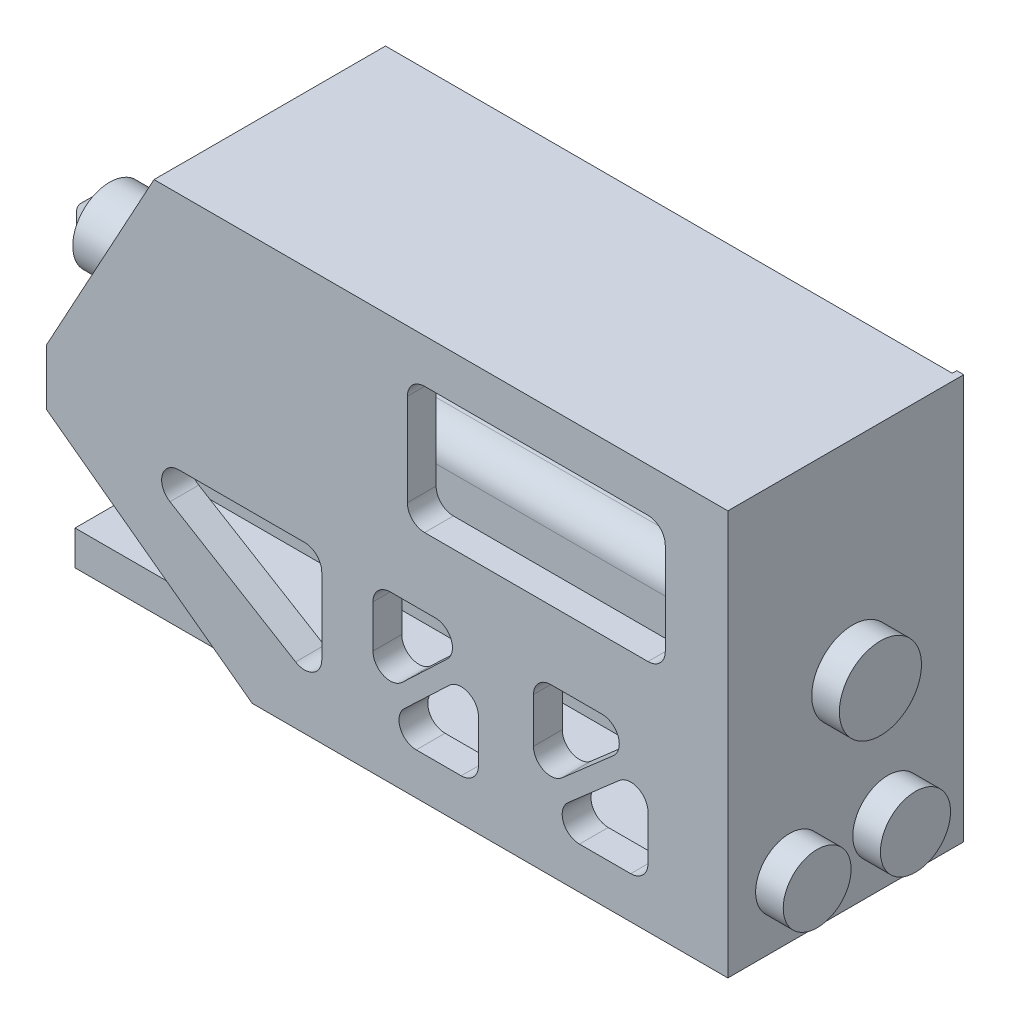
from build123d import *

# Parameters (mm, degrees)
SKETCH1_W           = 297.73626
SKETCH1_H           = 182.7784
BOSS_EXTRUDE1_DEPTH = 15.24
CUT_EXTRUDE1_DEPTH  = 350.695698609
CUT_EXTRUDE2_DEPTH  = 350.695698609
SKETCH5_W           = 297.73626
SKETCH5_H           = 50.702926555
BOSS_EXTRUDE2_DEPTH = 76.2
FILLET1_R           = 12.7
FILLET2_R           = 12.7
SKETCH6_R           = 16.245750799
BOSS_EXTRUDE3_DEPTH = 50.8
SKETCH7_R           = 11.813796097
BOSS_EXTRUDE4_DEPTH = 12.7
CHAMFER1_SIZE       = 10
SKETCH8_R           = 1.248823532
CUT_EXTRUDE3_DEPTH  = 12.7
BOSS_EXTRUDE5_DEPTH = 12.7
BOSS_EXTRUDE6_DEPTH = 89.408
SKETCH11_W          = 104.0892
SKETCH11_H          = 178.532208179
BOSS_EXTRUDE7_DEPTH = 3.048
SKETCH12_R          = 15.475849778
SKETCH12_R_2        = 18.114114382
SKETCH12_R_3        = 14.983279797
BOSS_EXTRUDE8_DEPTH = 12.192


with BuildPart() as part:
    # Sketch1 → Boss-Extrude1 (new body)
    with BuildSketch(Plane(origin=(0, 0, 0), x_dir=(1, 0, 0), z_dir=(0, 1, 0))):
        with Locations((148.86813, 91.3892)):
            Rectangle(SKETCH1_W, SKETCH1_H)
    extrude(amount=BOSS_EXTRUDE1_DEPTH)

    # Sketch2 → Cut-Extrude1 (cut, through all)
    with BuildSketch(Plane.ZY):
        with BuildLine():
            ThreePointArc((-43.45432, 0), (-56.15432, 12.7), (-68.85432, 0))
            Line((-68.85432, 0), (-43.45432, 0))
        make_face()
        with BuildLine():
            ThreePointArc((-113.92408, 0), (-126.62408, 12.7), (-139.32408, 0))
            Line((-139.32408, 0), (-126.62408, 0))
            Line((-126.62408, 0), (-113.92408, 0))
        make_face()
    extrude(amount=-CUT_EXTRUDE1_DEPTH, mode=Mode.SUBTRACT)

    # Sketch4 → Cut-Extrude2 (cut, through all)
    with BuildSketch(Plane.ZY):
        with BuildLine():
            Line((-113.92408, 0), (-91.3892, 0))
            Line((-91.3892, 0), (-91.3892, 15.24))
            Line((-91.3892, 15.24), (-182.7784, 15.24))
            Line((-182.7784, 15.24), (-182.7784, 0))
            Line((-182.7784, 0), (-139.32408, 0))
            ThreePointArc((-139.32408, 0), (-126.62408, 12.7), (-113.92408, 0))
        make_face()
    extrude(amount=-CUT_EXTRUDE2_DEPTH, mode=Mode.SUBTRACT)

    # Sketch5 → Boss-Extrude2 (add)
    with BuildSketch(Plane(origin=(0, 15.24, 0), x_dir=(1, 0, 0), z_dir=(0, 1, 0))):
        with Locations((148.86813, 66.037736723)):
            Rectangle(SKETCH5_W, SKETCH5_H)
    extrude(amount=BOSS_EXTRUDE2_DEPTH)

    # Fillet1
    fillet1_edges = [part.edges().sort_by_distance(p)[0] for p in [
        (148.86813, 91.44, -91.3892),
    ]]
    fillet(fillet1_edges, radius=FILLET1_R)

    # Fillet2
    fillet2_edges = [part.edges().sort_by_distance(p)[0] for p in [
        (148.86813, 91.44, -40.686273445),
    ]]
    fillet(fillet2_edges, radius=FILLET2_R)

    # Sketch6 → Boss-Extrude3 (add)
    with BuildSketch(Plane.ZY):
        with Locations(Location((-66.037736722, 72.73477654, 0), (0, 0, 180))):
            Circle(SKETCH6_R)
    extrude(amount=BOSS_EXTRUDE3_DEPTH)

    # Sketch7 → Boss-Extrude4 (add)
    with BuildSketch(Plane.ZY.offset(50.8)):
        with Locations((-66.037736722, 72.73477654)):
            Circle(SKETCH7_R)
    extrude(amount=BOSS_EXTRUDE4_DEPTH)

    # Chamfer1
    chamfer1_edges = [part.edges().sort_by_distance(p)[0] for p in [
        (-63.5, 72.73477654, -77.851532819),
    ]]
    chamfer(chamfer1_edges, length=CHAMFER1_SIZE)

    # Sketch8 → Cut-Extrude3 (cut)
    with BuildSketch(Plane.ZY.offset(63.5)):
        with Locations((-66.037736722, 72.73477654)):
            Circle(SKETCH8_R)
    extrude(amount=-CUT_EXTRUDE3_DEPTH, mode=Mode.SUBTRACT)

    # Sketch9 → Boss-Extrude5 (add)
    with BuildSketch(Plane.XY):
        Polygon((297.73626, 0), (90.894406839, 0), (0, 67.007031279), (0, 91.44), (47.551027836, 178.532208179), (90.894406839, 178.532208179), (297.73626, 178.532208179), align=None)
        with BuildLine():
            Line((58.530996724, 73.070623488), (113.961199629, 73.070623488))
            ThreePointArc((113.961199629, 73.070623488), (119.349353302, 70.83877716), (121.581199629, 65.450623488))
            Line((121.581199629, 65.450623488), (121.581199629, 31.944306806))
            ThreePointArc((121.581199629, 31.944306806), (117.704665398, 25.307224312), (110.019293058, 25.423128034))
            Line((110.019293058, 25.423128034), (54.589090153, 58.929444715))
            ThreePointArc((54.589090153, 58.929444715), (51.190840655, 67.496719496), (58.530996724, 73.070623488))
        make_face(mode=Mode.SUBTRACT)
        with BuildLine():
            Line((265.539203866, 159.20856434), (166.955187388, 159.20856434))
            ThreePointArc((166.955187388, 159.20856434), (161.567033715, 156.976718013), (159.335187388, 151.58856434))
            Line((159.335187388, 151.58856434), (159.335187388, 110.936484564))
            ThreePointArc((159.335187388, 110.936484564), (161.567033715, 105.548330891), (166.955187388, 103.316484564))
            Line((166.955187388, 103.316484564), (265.539203866, 103.316484564))
            ThreePointArc((265.539203866, 103.316484564), (270.927357539, 105.548330891), (273.159203866, 110.936484564))
            Line((273.159203866, 110.936484564), (273.159203866, 151.58856434))
            ThreePointArc((273.159203866, 151.58856434), (270.927357539, 156.976718013), (265.539203866, 159.20856434))
        make_face(mode=Mode.SUBTRACT)
        with BuildLine():
            Line((144.177739207, 65.450623488), (144.177739207, 46.629358654))
            ThreePointArc((144.177739207, 46.629358654), (148.790363397, 39.627923749), (157.043904755, 41.102863649))
            Line((157.043904755, 41.102863649), (176.87088603, 59.924128483))
            ThreePointArc((176.87088603, 59.924128483), (178.70201841, 68.274849759), (171.624720482, 73.070623488))
            Line((171.624720482, 73.070623488), (151.797739207, 73.070623488))
            ThreePointArc((151.797739207, 73.070623488), (146.409585534, 70.83877716), (144.177739207, 65.450623488))
        make_face(mode=Mode.SUBTRACT)
        with BuildLine():
            Line((183.099865501, 18.43421436), (163.272884226, 18.43421436))
            ThreePointArc((163.272884226, 18.43421436), (156.195586298, 23.229988089), (158.026718678, 31.580709365))
            Line((158.026718678, 31.580709365), (177.853699953, 50.401974198))
            ThreePointArc((177.853699953, 50.401974198), (186.107241311, 51.876914099), (190.719865501, 44.875479193))
            Line((190.719865501, 44.875479193), (190.719865501, 26.05421436))
            ThreePointArc((190.719865501, 26.05421436), (188.488019173, 20.666060687), (183.099865501, 18.43421436))
        make_face(mode=Mode.SUBTRACT)
        with BuildLine():
            Line((215.002714002, 65.450623488), (215.002714002, 45.672508012))
            ThreePointArc((215.002714002, 45.672508012), (219.472522634, 38.734158472), (227.638066848, 39.935728791))
            Line((227.638066848, 39.935728791), (250.261137525, 59.713844266))
            ThreePointArc((250.261137525, 59.713844266), (252.379460368, 68.129255819), (245.245784679, 73.070623488))
            Line((245.245784679, 73.070623488), (222.622714002, 73.070623488))
            ThreePointArc((222.622714002, 73.070623488), (217.234560329, 70.83877716), (215.002714002, 65.450623488))
        make_face(mode=Mode.SUBTRACT)
        with BuildLine():
            Line((235.296133189, 18.43421436), (257.919203866, 18.43421436))
            ThreePointArc((257.919203866, 18.43421436), (263.307357539, 20.666060687), (265.539203866, 26.05421436))
            Line((265.539203866, 26.05421436), (265.539203866, 45.832329836))
            ThreePointArc((265.539203866, 45.832329836), (261.069395235, 52.770679376), (252.903851021, 51.569109057))
            Line((252.903851021, 51.569109057), (230.280780343, 31.790993581))
            ThreePointArc((230.280780343, 31.790993581), (228.1624575, 23.375582029), (235.296133189, 18.43421436))
        make_face(mode=Mode.SUBTRACT)
    extrude(amount=BOSS_EXTRUDE5_DEPTH)

    # Sketch10 → Boss-Extrude6 (add)
    with BuildSketch(Plane(origin=(0, 0, 0), x_dir=(-1, 0, 0), z_dir=(0, 0, -1))):
        Polygon((-47.58427569, 178.532208179), (0, 91.44), (-8.220392821, 91.44), (-52.613193371, 172.690937859), (-297.73626, 172.690937859), (-297.73626, 178.532208179), align=None)
    extrude(amount=BOSS_EXTRUDE6_DEPTH)

    # Sketch11 → Boss-Extrude7 (add)
    with BuildSketch(Plane(origin=(297.73626, 0, 0), x_dir=(0, 0, -1), z_dir=(1, 0, 0))):
        with Locations((39.3446, 89.26610409)):
            Rectangle(SKETCH11_W, SKETCH11_H)
    extrude(amount=BOSS_EXTRUDE7_DEPTH)

    # Sketch12 → Boss-Extrude8 (add)
    with BuildSketch(Plane(origin=(300.78426, 0, 0), x_dir=(0, 0, -1), z_dir=(1, 0, 0))):
        with Locations(Location((57.905976466, 26.649412399, 0), (0, 0, 180))):
            Circle(SKETCH12_R)
        with Locations(Location((42.430126688, 89.26610409, 0), (0, 0, 180))):
            Circle(SKETCH12_R_2)
        with Locations(Location((14.521554365, 26.649412399, 0), (0, 0, 180))):
            Circle(SKETCH12_R_3)
    extrude(amount=BOSS_EXTRUDE8_DEPTH)


solid = part.part
